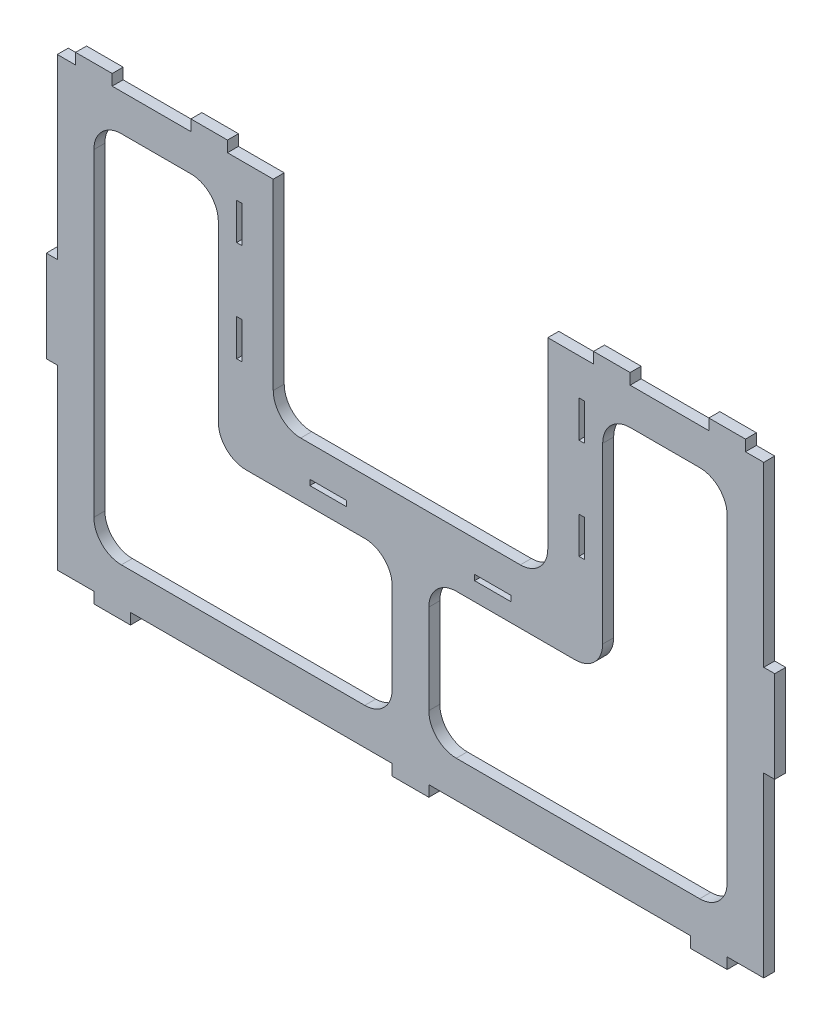
from build123d import *

# Parameters (mm, degrees)
SKETCH_1_W      = 3
SKETCH_1_H      = 20
SKETCH_1_W_2    = 20
SKETCH_1_H_2    = 3
EXTRUDE_1_DEPTH = 6
FILLET_2_R      = 15
FILLET_3_R      = 15
FILLET_4_R      = 15
FILLET_5_R      = 15
FILLET_6_R      = 15
FILLET_7_R      = 15
FILLET_8_R      = 15
FILLET_9_R      = 15
FILLET_10_R     = 15
FILLET_11_R     = 15
FILLET_12_R     = 15
FILLET_13_R     = 15
FILLET_14_R     = 15
FILLET_15_R     = 15


with BuildPart() as part:
    # Эскиз1 → Бобышка-Вытянуть1 (new body)
    with BuildSketch(Plane.XY):
        Polygon((118, 244), (118, 129), (268, 129), (268, 244), (293, 244), (293, 250), (313, 250), (313, 244), (356, 244), (356, 250), (376, 250), (376, 244), (386, 244), (386, 147), (392, 147), (392, 97), (386, 97), (386, 0), (366, 0), (366, -6), (346, -6), (346, 0), (203, 0), (203, -6), (183, -6), (183, 0), (40, 0), (40, -6), (20, -6), (20, 0), (0, 0), (0, 97), (-6, 97), (-6, 147), (0, 147), (0, 244), (10, 244), (10, 250), (30, 250), (30, 244), (73, 244), (73, 250), (93, 250), (93, 244), align=None)
        Polygon((20, 20), (20, 224), (88, 224), (88, 99), (183, 99), (183, 20), align=None, mode=Mode.SUBTRACT)
        Polygon((298, 99), (298, 224), (366, 224), (366, 20), (203, 20), (203, 99), align=None, mode=Mode.SUBTRACT)
        with Locations((99.5, 214)):
            Rectangle(SKETCH_1_W, SKETCH_1_H, mode=Mode.SUBTRACT)
        with Locations((99.5, 159)):
            Rectangle(SKETCH_1_W, SKETCH_1_H, mode=Mode.SUBTRACT)
        with Locations((148, 110.5)):
            Rectangle(SKETCH_1_W_2, SKETCH_1_H_2, mode=Mode.SUBTRACT)
        with Locations((238, 110.5)):
            Rectangle(SKETCH_1_W_2, SKETCH_1_H_2, mode=Mode.SUBTRACT)
        with Locations((286.5, 214)):
            Rectangle(SKETCH_1_W, SKETCH_1_H, mode=Mode.SUBTRACT)
        with Locations((286.5, 159)):
            Rectangle(SKETCH_1_W, SKETCH_1_H, mode=Mode.SUBTRACT)
    extrude(amount=EXTRUDE_1_DEPTH)

    # Скругление2
    fillet_2_edges = [part.edges().sort_by_distance(p)[0] for p in [
        (366, 20, 3),
    ]]
    fillet(fillet_2_edges, radius=FILLET_2_R)

    # Скругление3
    fillet_3_edges = [part.edges().sort_by_distance(p)[0] for p in [
        (203, 99, 3),
    ]]
    fillet(fillet_3_edges, radius=FILLET_3_R)

    # Скругление4
    fillet_4_edges = [part.edges().sort_by_distance(p)[0] for p in [
        (203, 20, 3),
    ]]
    fillet(fillet_4_edges, radius=FILLET_4_R)

    # Скругление5
    fillet_5_edges = [part.edges().sort_by_distance(p)[0] for p in [
        (298, 99, 3),
    ]]
    fillet(fillet_5_edges, radius=FILLET_5_R)

    # Скругление6
    fillet_6_edges = [part.edges().sort_by_distance(p)[0] for p in [
        (298, 224, 3),
    ]]
    fillet(fillet_6_edges, radius=FILLET_6_R)

    # Скругление7
    fillet_7_edges = [part.edges().sort_by_distance(p)[0] for p in [
        (366, 224, 3),
    ]]
    fillet(fillet_7_edges, radius=FILLET_7_R)

    # Скругление8
    fillet_8_edges = [part.edges().sort_by_distance(p)[0] for p in [
        (183, 99, 3),
    ]]
    fillet(fillet_8_edges, radius=FILLET_8_R)

    # Скругление9
    fillet_9_edges = [part.edges().sort_by_distance(p)[0] for p in [
        (20, 224, 3),
    ]]
    fillet(fillet_9_edges, radius=FILLET_9_R)

    # Скругление10
    fillet_10_edges = [part.edges().sort_by_distance(p)[0] for p in [
        (88, 99, 3),
    ]]
    fillet(fillet_10_edges, radius=FILLET_10_R)

    # Скругление11
    fillet_11_edges = [part.edges().sort_by_distance(p)[0] for p in [
        (88, 224, 3),
    ]]
    fillet(fillet_11_edges, radius=FILLET_11_R)

    # Скругление12
    fillet_12_edges = [part.edges().sort_by_distance(p)[0] for p in [
        (183, 20, 3),
    ]]
    fillet(fillet_12_edges, radius=FILLET_12_R)

    # Скругление13
    fillet_13_edges = [part.edges().sort_by_distance(p)[0] for p in [
        (20, 20, 3),
    ]]
    fillet(fillet_13_edges, radius=FILLET_13_R)

    # Скругление14
    fillet_14_edges = [part.edges().sort_by_distance(p)[0] for p in [
        (268, 129, 3),
    ]]
    fillet(fillet_14_edges, radius=FILLET_14_R)

    # Скругление15
    fillet_15_edges = [part.edges().sort_by_distance(p)[0] for p in [
        (118, 129, 3),
    ]]
    fillet(fillet_15_edges, radius=FILLET_15_R)


solid = part.part
